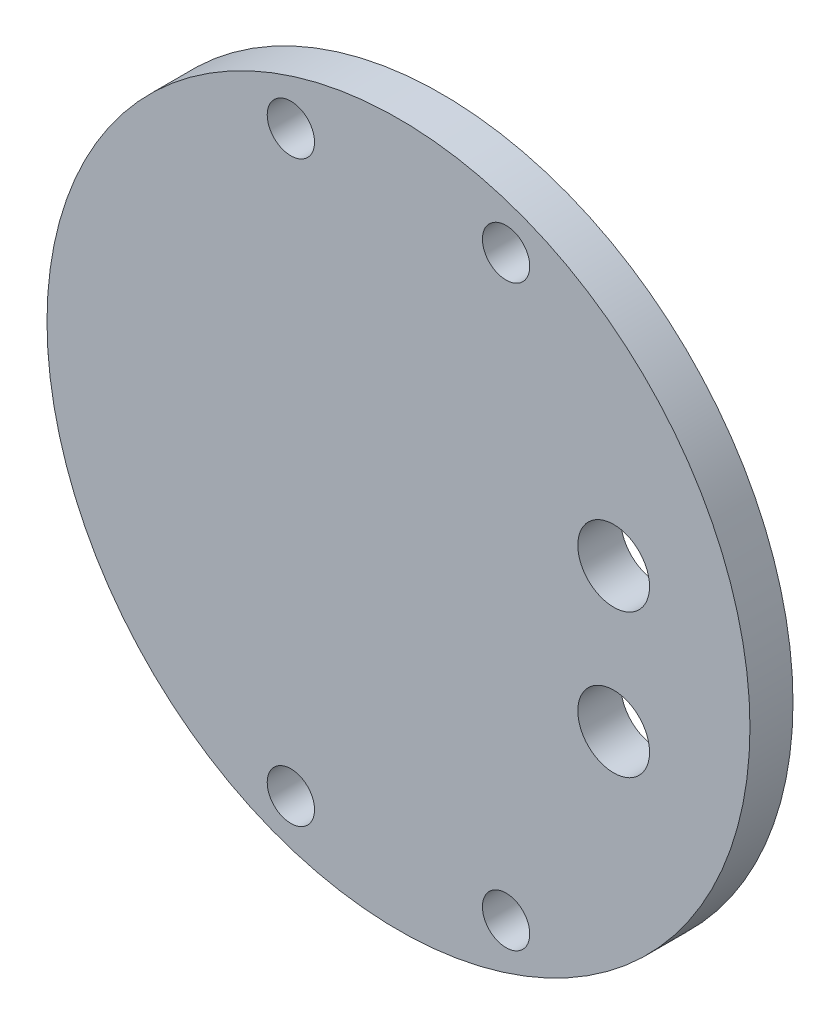
from build123d import *

# Parameters (mm, degrees)
SKETCH_1_R          = 49
SKETCH_1_R_2        = 3.3
EXTRUDE_1_DEPTH     = 6
SKETCH_2_R          = 5
CUT_EXTRUDE_1_DEPTH = 70.555733049


with BuildPart() as part:
    # 草图1 → 凸台-拉伸1 (new body)
    with BuildSketch(Plane.XY.offset(6)):
        with Locations(Location((0, 0, 0), (0, 0, 180))):
            Circle(SKETCH_1_R)
        with Locations(Location((15, 40.300002161, 0), (0, 0, 180))):
            Circle(SKETCH_1_R_2, mode=Mode.SUBTRACT)
        with Locations(Location((15, -40.300002161, 0), (0, 0, 180))):
            Circle(SKETCH_1_R_2, mode=Mode.SUBTRACT)
        with Locations(Location((-15, 40.300002161, 0), (0, 0, 180))):
            Circle(SKETCH_1_R_2, mode=Mode.SUBTRACT)
        with Locations(Location((-15, -40.300002161, 0), (0, 0, 180))):
            Circle(SKETCH_1_R_2, mode=Mode.SUBTRACT)
    extrude(amount=-EXTRUDE_1_DEPTH)

    # 草图2 → 切除-拉伸1 (cut, through all)
    with BuildSketch(Plane.XY.offset(6)):
        with Locations((30, 10)):
            Circle(SKETCH_2_R)
        with Locations((30, -10)):
            Circle(SKETCH_2_R)
    extrude(amount=-CUT_EXTRUDE_1_DEPTH, mode=Mode.SUBTRACT)


solid = part.part
